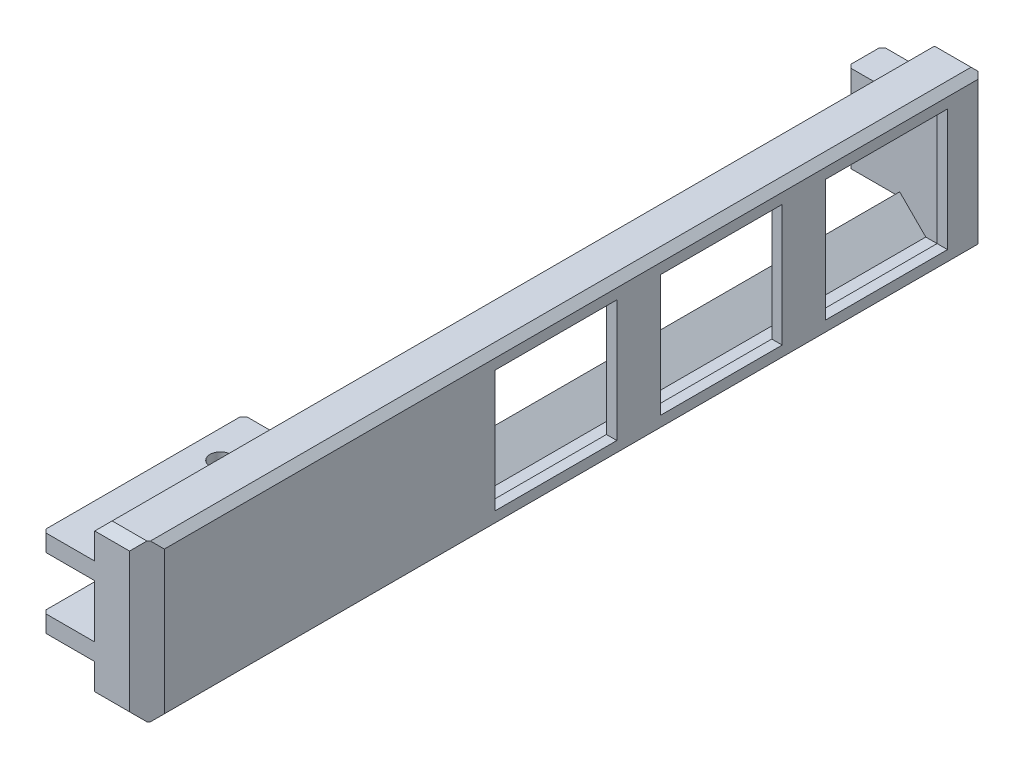
from build123d import *

# Parameters (mm, degrees)
SKETCH_2_W          = 96.5
SKETCH_2_H          = 18
EXTRUDE_1_DEPTH     = 12
SKETCH_3_W          = 14
SKETCH_3_H          = 14
CUT_EXTRUDE_1_DEPTH = 1.2
SKETCH_4_W          = 56
SKETCH_4_H          = 15
CUT_EXTRUDE_2_DEPTH = 4.8
CHAMFER_1_SIZE      = 0.3
CHAMFER_2_SIZE      = 3
SKETCH_6_W          = 6
SKETCH_6_H          = 4
CUT_EXTRUDE_3_DEPTH = 99.895146494
CUT_EXTRUDE_START   = -4
SKETCH_6_4_W        = 6
SKETCH_6_4_H        = 6.1
CUT_EXTRUDE_5_DEPTH = 95.895146494
SKETCH_7_W          = 69.4
SKETCH_7_H          = 10
CUT_EXTRUDE_4_DEPTH = 6
CHAMFER_3_SIZE      = 0.4
SKETCH_8_R          = 1.2
CUT_EXTRUDE_6_DEPTH = 99.245865053
SKETCH_9_R          = 2.05
CUT_EXTRUDE_7_DEPTH = 2
SKETCH_9_3_R        = 1.2
CUT_EXTRUDE_8_DEPTH = 99.895146494
CHAMFER_4_SIZE      = 1
CHAMFER_5_SIZE      = 2
CHAMFER_6_SIZE      = 0.8
CHAMFER_7_SIZE      = 1


with BuildPart() as part:
    # 草图2 → 凸台-拉伸1 (new body)
    with BuildSketch(Plane(origin=(0, 0, 0), x_dir=(0, 0, -1), z_dir=(1, 0, 0))):
        with Locations((48.25, 9)):
            Rectangle(SKETCH_2_W, SKETCH_2_H)
    extrude(amount=EXTRUDE_1_DEPTH)

    # 草图3 → 切除-拉伸1 (cut)
    with BuildSketch(Plane(origin=(12, 0, 0), x_dir=(0, 0, -1), z_dir=(1, 0, 0))):
        with Locations((85, 9)):
            Rectangle(SKETCH_3_W, SKETCH_3_H)
        with Locations((66, 9)):
            Rectangle(SKETCH_3_W, SKETCH_3_H)
        with Locations((47, 9)):
            Rectangle(SKETCH_3_W, SKETCH_3_H)
    extrude(amount=-CUT_EXTRUDE_1_DEPTH, mode=Mode.SUBTRACT)

    # 草图4 → 切除-拉伸2 (cut)
    with BuildSketch(Plane(origin=(10.8, 0, 0), x_dir=(0, 0, -1), z_dir=(1, 0, 0))):
        with Locations((64.5, 9)):
            Rectangle(SKETCH_4_W, SKETCH_4_H)
    extrude(amount=-CUT_EXTRUDE_2_DEPTH, mode=Mode.SUBTRACT)

    # 倒角1
    chamfer_1_edges = [part.edges().sort_by_distance(p)[0] for p in [
        (10.8, 1.5, -64.5),
        (10.8, 16.5, -64.5),
    ]]
    chamfer(chamfer_1_edges, length=CHAMFER_1_SIZE)

    # 倒角2
    chamfer_2_edges = [part.edges().sort_by_distance(p)[0] for p in [
        (6, 16.5, -64.5),
        (6, 1.5, -64.5),
    ]]
    chamfer(chamfer_2_edges, length=CHAMFER_2_SIZE)

    # 草图6 → 切除-拉伸3 (cut, through all)
    with BuildSketch(Plane(origin=(0, 0, -96.5), x_dir=(-1, 0, 0), z_dir=(0, 0, -1))):
        with Locations((-3, 16)):
            Rectangle(SKETCH_6_W, SKETCH_6_H)
        with Locations((-3, 2)):
            Rectangle(SKETCH_6_W, SKETCH_6_H)
    extrude(amount=-CUT_EXTRUDE_3_DEPTH, mode=Mode.SUBTRACT)

    # 草图6<4> → 切除-拉伸5 (cut, through all)
    with BuildSketch(Plane(origin=(0, 0, -96.5), x_dir=(-1, 0, 0), z_dir=(0, 0, -1)).offset(CUT_EXTRUDE_START)):
        with Locations((-3, 9)):
            Rectangle(SKETCH_6_4_W, SKETCH_6_4_H)
    extrude(amount=-CUT_EXTRUDE_5_DEPTH, mode=Mode.SUBTRACT)

    # 草图7 → 切除-拉伸4 (cut)
    with BuildSketch(Plane.ZY):
        with Locations((-57.8, 9)):
            Rectangle(SKETCH_7_W, SKETCH_7_H)
    extrude(amount=-CUT_EXTRUDE_4_DEPTH, mode=Mode.SUBTRACT)

    # 倒角3
    chamfer_3_edges = [part.edges().sort_by_distance(p)[0] for p in [
        (0, 4.975, 0),
        (0, 9, -92.5),
        (3, 12.05, -23.1),
        (0, 13.025, -23.1),
        (3, 5.95, -23.1),
        (0, 4.975, -23.1),
        (0, 13.025, 0),
        (0, 9, -96.5),
    ]]
    chamfer(chamfer_3_edges, length=CHAMFER_3_SIZE)

    # 草图8 → 切除-拉伸6 (cut, through all)
    with BuildSketch(Plane(origin=(0, 14, 0), x_dir=(1, 0, 0), z_dir=(0, 1, 0))):
        with Locations(Location((3.2, 17.25, 0), (0, 0, 270))):
            Circle(SKETCH_8_R)
    extrude(amount=-CUT_EXTRUDE_6_DEPTH, mode=Mode.SUBTRACT)

    # 草图9 → 切除-拉伸7 (cut)
    with BuildSketch(Plane(origin=(0, 0, -96.5), x_dir=(-1, 0, 0), z_dir=(0, 0, -1))):
        with Locations((-3, 9)):
            Circle(SKETCH_9_R)
    extrude(amount=-CUT_EXTRUDE_7_DEPTH, mode=Mode.SUBTRACT)

    # 草图9<3> → 切除-拉伸8 (cut, through all)
    with BuildSketch(Plane(origin=(0, 0, -96.5), x_dir=(-1, 0, 0), z_dir=(0, 0, -1))):
        with Locations((-3, 9)):
            Circle(SKETCH_9_3_R)
    extrude(amount=-CUT_EXTRUDE_8_DEPTH, mode=Mode.SUBTRACT)

    # 倒角4
    chamfer_4_edges = [part.edges().sort_by_distance(p)[0] for p in [
        (6, 18, -48.25),
        (6, 0, -48.25),
        (12, 9, -96.5),
        (9, 18, -96.5),
        (9, 0, -96.5),
    ]]
    chamfer(chamfer_4_edges, length=CHAMFER_4_SIZE)

    # 倒角5
    chamfer_5_edges = [part.edges().sort_by_distance(p)[0] for p in [
        (12, 9, 0),
    ]]
    chamfer(chamfer_5_edges, length=CHAMFER_5_SIZE)

    # 倒角6
    chamfer_6_edges = [part.edges().sort_by_distance(p)[0] for p in [
        (12, 18, -48.75),
        (12, 0, -48.75),
    ]]
    chamfer(chamfer_6_edges, length=CHAMFER_6_SIZE)

    # 倒角7
    chamfer_7_edges = [part.edges().sort_by_distance(p)[0] for p in [
        (8.5, 0, 0),
        (8.5, 18, 0),
    ]]
    chamfer(chamfer_7_edges, length=CHAMFER_7_SIZE)


solid = part.part
